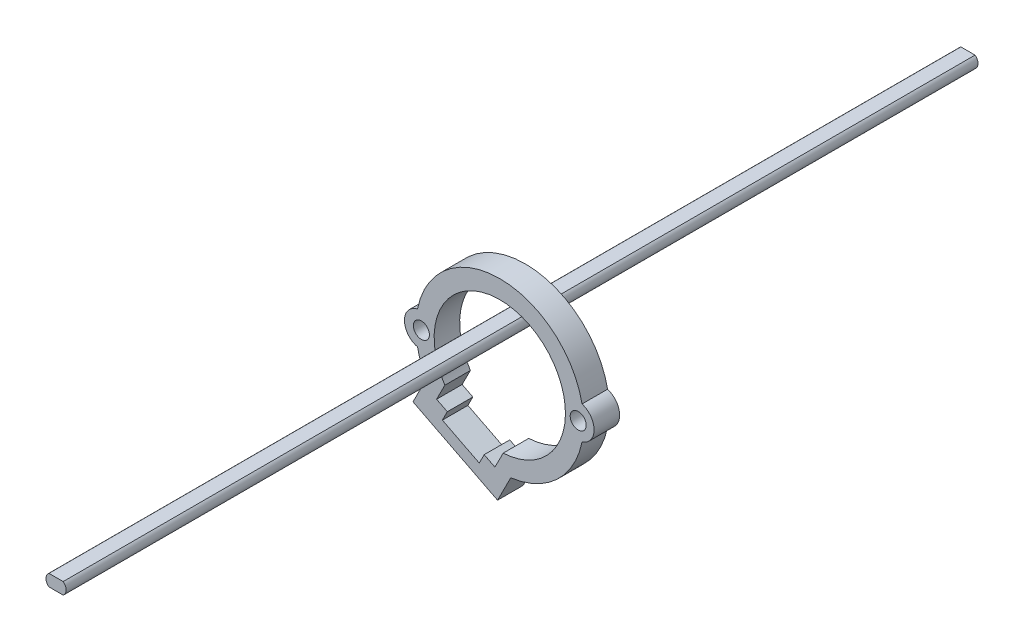
from build123d import *

# Parameters (mm, degrees)
SKETCH1_R           = 23
SKETCH1_R_2         = 18
BOSS_EXTRUDE1_DEPTH = 7
BOSS_EXTRUDE2_DEPTH = 7
CUT_EXTRUDE1_DEPTH  = 7
BOSS_EXTRUDE3_DEPTH = 7
SKETCH7_R           = 2.2
CUT_EXTRUDE2_DEPTH  = 7
CUT_EXTRUDE3_DEPTH  = 7
BOSS_EXTRUDE4_DEPTH = 125


with BuildPart() as part:
    # Sketch1 → Boss-Extrude1 (new body)
    with BuildSketch(Plane.XY):
        Circle(SKETCH1_R)
        Circle(SKETCH1_R_2, mode=Mode.SUBTRACT)
    extrude(amount=BOSS_EXTRUDE1_DEPTH)

    # Sketch3 → Boss-Extrude2 (add)
    with BuildSketch(Plane.XY):
        with BuildLine():
            Line((-23.80139919, -18.167885182), (-0.617388595, -29.936557696))
            Line((-0.617388595, -29.936557696), (3.003741409, -22.803015975))
            ThreePointArc((3.003741409, -22.803015975), (-10.410748762, -20.508932449), (-20.180269185, -11.034343461))
            Line((-20.180269185, -11.034343461), (-23.80139919, -18.167885182))
        make_face()
    extrude(amount=BOSS_EXTRUDE2_DEPTH)

    # Sketch5 → Cut-Extrude1 (cut)
    with BuildSketch(Plane.XY):
        with BuildLine():
            Line((-15.062285021, -9.855332057), (-17.325491273, -14.313795633))
            Line((-17.325491273, -14.313795633), (-1.328523963, -22.434179668))
            Line((-1.328523963, -22.434179668), (0.93468229, -17.975716092))
            ThreePointArc((0.93468229, -17.975716092), (-8.14754251, -16.050468873), (-15.062285021, -9.855332057))
        make_face()
    extrude(amount=CUT_EXTRUDE1_DEPTH, mode=Mode.SUBTRACT)

    # Sketch6 → Boss-Extrude3 (add)
    with BuildSketch(Plane.XY):
        with BuildLine():
            ThreePointArc((-22.555487137, -4.5), (-26.136916399, 0), (-22.555487137, 4.5))
            ThreePointArc((-22.555487137, 4.5), (-23, 0), (-22.555487137, -4.5))
        make_face()
        with BuildLine():
            ThreePointArc((22.555487137, -4.5), (25.860234666, 0), (22.555487137, 4.5))
            ThreePointArc((22.555487137, 4.5), (23, 0), (22.555487137, -4.5))
        make_face()
    extrude(amount=BOSS_EXTRUDE3_DEPTH)

    # Sketch7 → Cut-Extrude2 (cut)
    with BuildSketch(Plane.XY):
        with Locations((-21.5, 0)):
            Circle(SKETCH7_R)
        with Locations((21.5, 0)):
            Circle(SKETCH7_R)
    extrude(amount=CUT_EXTRUDE2_DEPTH, mode=Mode.SUBTRACT)

    # Sketch8 → Cut-Extrude3 (cut)
    with BuildSketch(Plane.XY):
        Polygon((-14.382905313, -15.80751176), (-4.271109923, -20.940463541), (-5.629033675, -23.615541687), (-15.740829065, -18.482589905), align=None)
    extrude(amount=CUT_EXTRUDE3_DEPTH, mode=Mode.SUBTRACT)


with BuildPart() as body_2:
    # Sketch9 → Boss-Extrude4 (new, symmetric)
    with BuildSketch(Plane.XY):
        with BuildLine():
            Line((-5.6, 9.21), (-1.7, 9.21))
            ThreePointArc((-1.7, 9.21), (-0.88654962, 7.6), (-1.7, 5.99))
            Line((-1.7, 5.99), (-5.6, 5.99))
            ThreePointArc((-5.6, 5.99), (-6.41345038, 7.6), (-5.6, 9.21))
        make_face()
    extrude(amount=BOSS_EXTRUDE4_DEPTH, both=True)


solid = Compound([part.part, body_2.part])
